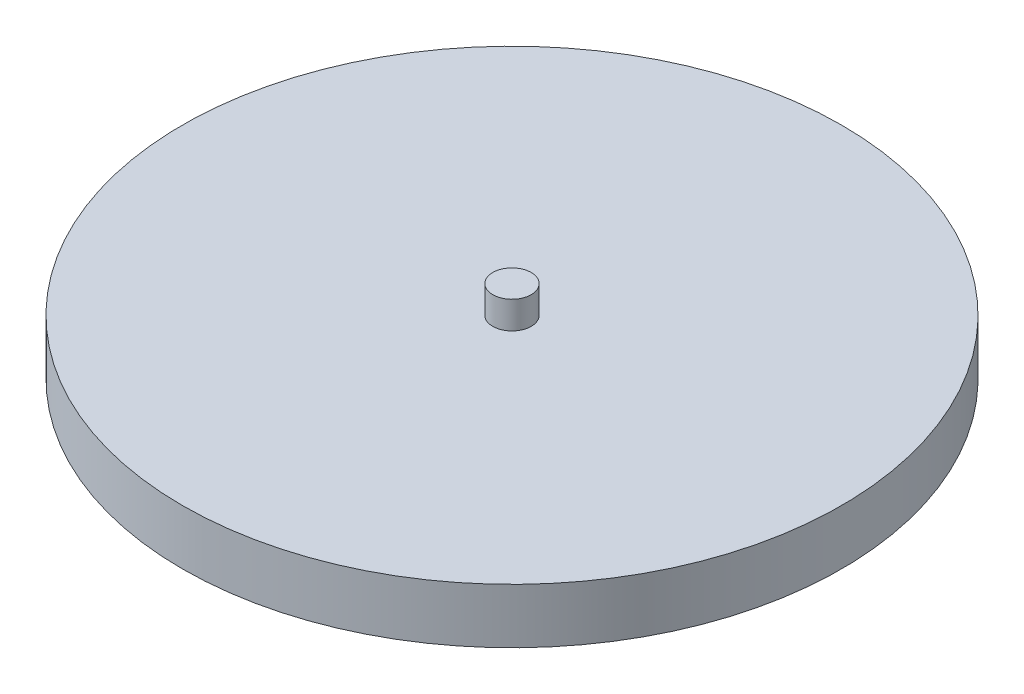
from build123d import *

# Parameters (mm, degrees)
SKETCH1_R           = 60
BOSS_EXTRUDE1_DEPTH = 10
SKETCH2_R           = 3.5
BOSS_EXTRUDE2_DEPTH = 5


with BuildPart() as part:
    # Sketch1 → Boss-Extrude1 (new body)
    with BuildSketch(Plane(origin=(0, 0, 0), x_dir=(1, 0, 0), z_dir=(0, 1, 0))):
        with Locations(Location((0, 0, 0), (0, 0, 270))):
            Circle(SKETCH1_R)
    extrude(amount=BOSS_EXTRUDE1_DEPTH)

    # Sketch2 → Boss-Extrude2 (add)
    with BuildSketch(Plane(origin=(0, 10, 0), x_dir=(1, 0, 0), z_dir=(0, 1, 0))):
        with Locations(Location((0, 0, 0), (0, 0, 270))):
            Circle(SKETCH2_R)
    extrude(amount=BOSS_EXTRUDE2_DEPTH)


solid = part.part
